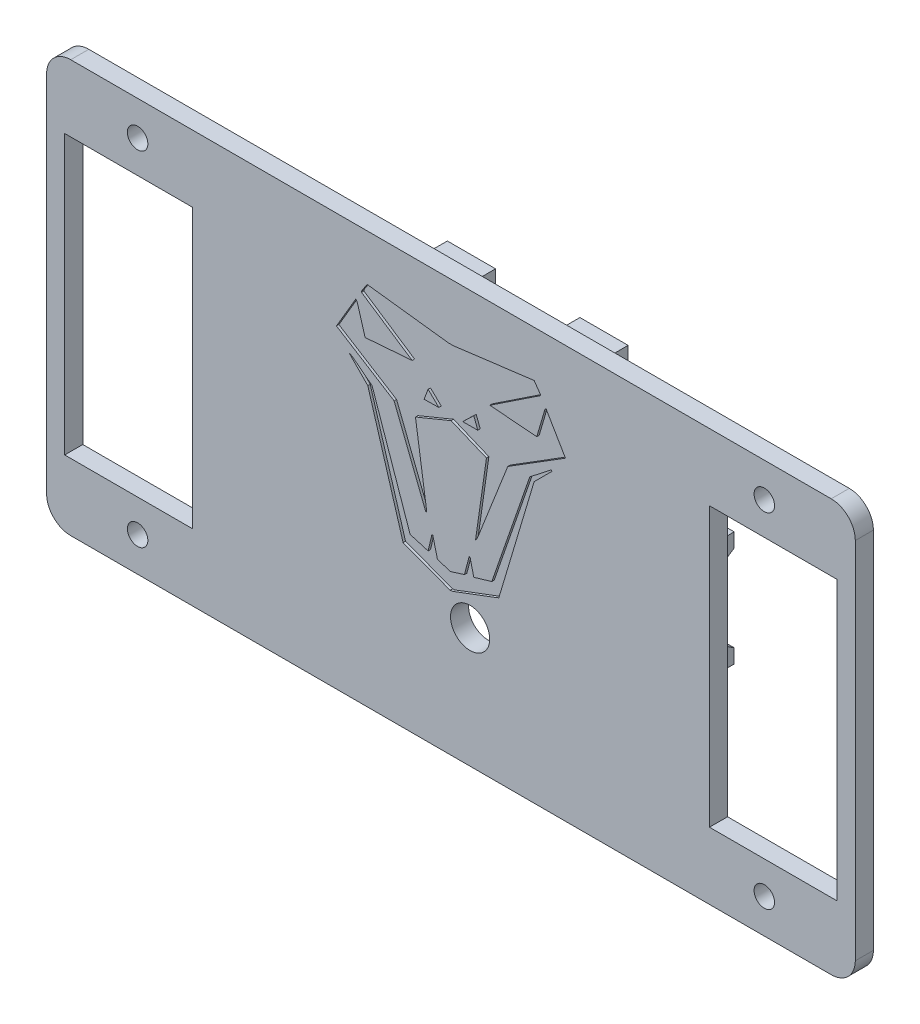
from build123d import *

# Parameters (mm, degrees)
LID_PLATE_START                    = 32.5
LID_FOOTPRINT_W                    = 134.2
LID_FOOTPRINT_H                    = 68.4
LID_PLATE_DEPTH                    = 3
WHEEL_CLEARANCE_WINDOWS_START      = 36
WHEEL_WELL_PROFILE_W               = 21.2
WHEEL_WELL_PROFILE_H               = 46.2
WHEEL_CLEARANCE_WINDOWS_DEPTH      = 5
LID_STIFFENING_RIBS_START          = 29.5
LID_RIB_PROFILE_W                  = 78
LID_RIB_PROFILE_H                  = 2.5
LID_STIFFENING_RIBS_DEPTH          = 3
LID_MOTOR_CLAMP_BLOCKS_START       = 23.6
UPPER_MOTOR_CLAMP_PROFILE_W        = 10
UPPER_MOTOR_CLAMP_PROFILE_H        = 19
LID_MOTOR_CLAMP_BLOCKS_DEPTH       = 8.9
UPPER_MOTOR_CLAMP_SEATS_R8P2_START = 36
UPPER_CLAMP_RADIUS_PROFILE_R       = 8.2
UPPER_MOTOR_CLAMP_SEATS_R8P2_DEPTH = 72
REGISTRATION_TABS_START            = 31
LID_REGISTRATION_PROFILE_W         = 32
LID_REGISTRATION_PROFILE_H         = 0.9
REGISTRATION_TABS_DEPTH            = 1.5
BATTERY_SOFT_PAD_STOPS_START       = 21.1
BATTERY_UPPER_STOP_PROFILE_W       = 8
BATTERY_UPPER_STOP_PROFILE_H       = 8
BATTERY_SOFT_PAD_STOPS_DEPTH       = 11.4
LID_M3_CLEARANCE_HOLES_START       = 36
LID_M3_CLEARANCE_PROFILE_R         = 1.7
LID_M3_CLEARANCE_HOLES_DEPTH       = 5
SWITCH_RETENTION_RAILS_START       = 18.4
SWITCH_RETENTION_RAIL_PROFILE_W    = 1.7
SWITCH_RETENTION_RAIL_PROFILE_H    = 8.3
SWITCH_RETENTION_RAILS_DEPTH       = 14.1
SWITCH_RETENTION_LEDGES_START      = 17.4
SWITCH_RETENTION_LEDGE_PROFILE_W   = 2.7
SWITCH_RETENTION_LEDGE_PROFILE_H   = 8.3
SWITCH_RETENTION_LEDGES_DEPTH      = 1
SWITCH_TOOL_ACCESS_START           = 36
SWITCH_TOOL_ACCESS_PROFILE_R       = 3.25
SWITCH_TOOL_ACCESS_DEPTH           = 5
LID_OUTER_CORNERS_R4_R             = 4
SNAKE_LOGO_ENGRAVED_START          = 35.5
SNAKE_LOGO_ENGRAVED_DEPTH          = 0.4


with BuildPart() as part:
    # Lid_Footprint → Lid_Plate (new body)
    with BuildSketch(Plane.XY.offset(LID_PLATE_START)):
        Rectangle(LID_FOOTPRINT_W, LID_FOOTPRINT_H)
    extrude(amount=LID_PLATE_DEPTH)

    # Wheel_Well_Profile → Wheel_Clearance_Windows (cut)
    with BuildSketch(Plane.XY.offset(WHEEL_CLEARANCE_WINDOWS_START)):
        with Locations((53.5, 0)):
            Rectangle(WHEEL_WELL_PROFILE_W, WHEEL_WELL_PROFILE_H)
        with Locations((-53.5, 0)):
            Rectangle(WHEEL_WELL_PROFILE_W, WHEEL_WELL_PROFILE_H)
    extrude(amount=-WHEEL_CLEARANCE_WINDOWS_DEPTH, mode=Mode.SUBTRACT)

    # Lid_Rib_Profile → Lid_Stiffening_Ribs (add)
    with BuildSketch(Plane.XY.offset(LID_STIFFENING_RIBS_START)):
        with Locations((0, -6.75)):
            Rectangle(LID_RIB_PROFILE_W, LID_RIB_PROFILE_H)
        with Locations((0, 6.75)):
            Rectangle(LID_RIB_PROFILE_W, LID_RIB_PROFILE_H)
    extrude(amount=LID_STIFFENING_RIBS_DEPTH)

    # Upper_Motor_Clamp_Profile → Lid_Motor_Clamp_Blocks (add)
    with BuildSketch(Plane.XY.offset(LID_MOTOR_CLAMP_BLOCKS_START)):
        with Locations((-30.1, 0)):
            Rectangle(UPPER_MOTOR_CLAMP_PROFILE_W, UPPER_MOTOR_CLAMP_PROFILE_H)
        with Locations((30.1, 0)):
            Rectangle(UPPER_MOTOR_CLAMP_PROFILE_W, UPPER_MOTOR_CLAMP_PROFILE_H)
    extrude(amount=LID_MOTOR_CLAMP_BLOCKS_DEPTH)

    # Upper_Clamp_Radius_Profile → Upper_Motor_Clamp_Seats_R8p2 (cut)
    with BuildSketch(Plane(origin=(0, 0, 0), x_dir=(0, 0, -1), z_dir=(1, 0, 0)).offset(UPPER_MOTOR_CLAMP_SEATS_R8P2_START)):
        with Locations((-19.6, 0)):
            Circle(UPPER_CLAMP_RADIUS_PROFILE_R)
    extrude(amount=-UPPER_MOTOR_CLAMP_SEATS_R8P2_DEPTH, mode=Mode.SUBTRACT)

    # Lid_Registration_Profile → Registration_Tabs (add)
    with BuildSketch(Plane.XY.offset(REGISTRATION_TABS_START)):
        with Locations((-16.5, 30.45)):
            Rectangle(LID_REGISTRATION_PROFILE_W, LID_REGISTRATION_PROFILE_H)
        with Locations((16.5, 30.45)):
            Rectangle(LID_REGISTRATION_PROFILE_W, LID_REGISTRATION_PROFILE_H)
        with Locations((-16.5, -30.45)):
            Rectangle(LID_REGISTRATION_PROFILE_W, LID_REGISTRATION_PROFILE_H)
        with Locations((16.5, -30.45)):
            Rectangle(LID_REGISTRATION_PROFILE_W, LID_REGISTRATION_PROFILE_H)
    extrude(amount=REGISTRATION_TABS_DEPTH)

    # Battery_Upper_Stop_Profile → Battery_Soft_Pad_Stops (add)
    with BuildSketch(Plane.XY.offset(BATTERY_SOFT_PAD_STOPS_START)):
        with Locations((-11, 21)):
            Rectangle(BATTERY_UPPER_STOP_PROFILE_W, BATTERY_UPPER_STOP_PROFILE_H)
        with Locations((11, 21)):
            Rectangle(BATTERY_UPPER_STOP_PROFILE_W, BATTERY_UPPER_STOP_PROFILE_H)
    extrude(amount=BATTERY_SOFT_PAD_STOPS_DEPTH)

    # Lid_M3_Clearance_Profile → Lid_M3_Clearance_Holes (cut)
    with BuildSketch(Plane.XY.offset(LID_M3_CLEARANCE_HOLES_START)):
        with Locations(Location((-52, -28.5, 0), (0, 0, 180))):
            Circle(LID_M3_CLEARANCE_PROFILE_R)
        with Locations(Location((-52, 28.5, 0), (0, 0, 180))):
            Circle(LID_M3_CLEARANCE_PROFILE_R)
        with Locations(Location((52, -28.5, 0), (0, 0, 180))):
            Circle(LID_M3_CLEARANCE_PROFILE_R)
        with Locations(Location((52, 28.5, 0), (0, 0, 180))):
            Circle(LID_M3_CLEARANCE_PROFILE_R)
    extrude(amount=-LID_M3_CLEARANCE_HOLES_DEPTH, mode=Mode.SUBTRACT)

    # Switch_Retention_Rail_Profile → Switch_Retention_Rails (add)
    with BuildSketch(Plane.XY.offset(SWITCH_RETENTION_RAILS_START)):
        with Locations((-10.65, -14.35)):
            Rectangle(SWITCH_RETENTION_RAIL_PROFILE_W, SWITCH_RETENTION_RAIL_PROFILE_H)
        with Locations((10.65, -14.35)):
            Rectangle(SWITCH_RETENTION_RAIL_PROFILE_W, SWITCH_RETENTION_RAIL_PROFILE_H)
    extrude(amount=SWITCH_RETENTION_RAILS_DEPTH)

    # Switch_Retention_Ledge_Profile → Switch_Retention_Ledges (add)
    with BuildSketch(Plane.XY.offset(SWITCH_RETENTION_LEDGES_START)):
        with Locations((-10.15, -14.35)):
            Rectangle(SWITCH_RETENTION_LEDGE_PROFILE_W, SWITCH_RETENTION_LEDGE_PROFILE_H)
        with Locations((10.15, -14.35)):
            Rectangle(SWITCH_RETENTION_LEDGE_PROFILE_W, SWITCH_RETENTION_LEDGE_PROFILE_H)
    extrude(amount=SWITCH_RETENTION_LEDGES_DEPTH)

    # Switch_Tool_Access_Profile → Switch_Tool_Access (cut)
    with BuildSketch(Plane.XY.offset(SWITCH_TOOL_ACCESS_START)):
        with Locations(Location((3.175, -14.325, 0), (0, 0, 180))):
            Circle(SWITCH_TOOL_ACCESS_PROFILE_R)
    extrude(amount=-SWITCH_TOOL_ACCESS_DEPTH, mode=Mode.SUBTRACT)

    # Lid_Outer_Corners_R4
    lid_outer_corners_r4_edges = [part.edges().sort_by_distance(p)[0] for p in [
        (-67.1, 34.2, 34),
        (67.1, 34.2, 34),
        (67.1, -34.2, 34),
        (-67.1, -34.2, 34),
    ]]
    fillet(lid_outer_corners_r4_edges, radius=LID_OUTER_CORNERS_R4_R)

    # Snake_Logo_Native_Profile → Snake_Logo_Engraved (cut)
    # profile 1 of 2: a face of its own
    with BuildSketch(Plane.XY.offset(SNAKE_LOGO_ENGRAVED_START)):
        Polygon((13.800582242, 26.557496361), (14.851528384, 25.064046579), (14.851528384, 24.898107715), (6.443959243, 19.311499272), (14.243085881, 18.703056769), (15.459970888, 22.851528384), (15.625909753, 23.349344978), (15.791848617, 23.459970888), (19, 17.983988355), (9.430858806, 12.010189229), (4.397379913, -0.767103348), (4.065502183, -1.320232897), (5.890829694, 11.45705968), (0.027656477, 13.890829694), (-5.890829694, 11.45705968), (-4.065502183, -0.877729258), (-4.065502183, -1.264919942), (-4.176128093, -1.320232897), (-9.430858806, 12.010189229), (-19, 17.983988355), (-15.791848617, 23.459970888), (-15.570596798, 23.183406114), (-14.243085881, 18.703056769), (-6.443959243, 19.311499272), (-14.851528384, 24.898107715), (-14.851528384, 25.064046579), (-13.911208151, 26.502183406), (-0.414847162, 24.84279476), (0.414847162, 24.84279476), align=None)
        Polygon((-4.452692868, 14.720524017), (-2.018922853, 14.775836972), (-3.788937409, 16.490538574), align=None, mode=Mode.SUBTRACT)
        Polygon((1.963609898, 14.720524017), (4.452692868, 14.720524017), (3.788937409, 16.490538574), align=None, mode=Mode.SUBTRACT)
    # profile 2 of 2: a face of its own
    with BuildSketch(Plane.XY.offset(SNAKE_LOGO_ENGRAVED_START)):
        Polygon((-16.84279476, 15.107714702), (-16.566229985, 15.052401747), (-16.62154294, 14.941775837), (-16.510917031, 14.997088792), (-15.902474527, 14.554585153), (-13.136826783, 12.397379913), (-13.026200873, 12.176128093), (-6.775836972, -5.855895197), (-3.788937409, -6.740902475), (-3.180494905, -4.141193595), (-3.014556041, -4.08588064), (-2.240174672, -7.183406114), (-0.082969432, -7.847161572), (2.240174672, -7.128093159), (3.014556041, -4.141193595), (3.180494905, -4.19650655), (3.788937409, -6.740902475), (6.775836972, -5.855895197), (13.081513828, 12.342066958), (16.62154294, 15.107714702), (16.787481805, 14.997088792), (13.800582242, 12.010189229), (7.937409025, -7.625909753), (0.304221252, -10.502183406), (-0.138282387, -10.557496361), (-7.937409025, -7.625909753), (-13.800582242, 12.010189229), align=None)
    extrude(amount=-SNAKE_LOGO_ENGRAVED_DEPTH, mode=Mode.SUBTRACT)


solid = part.part
